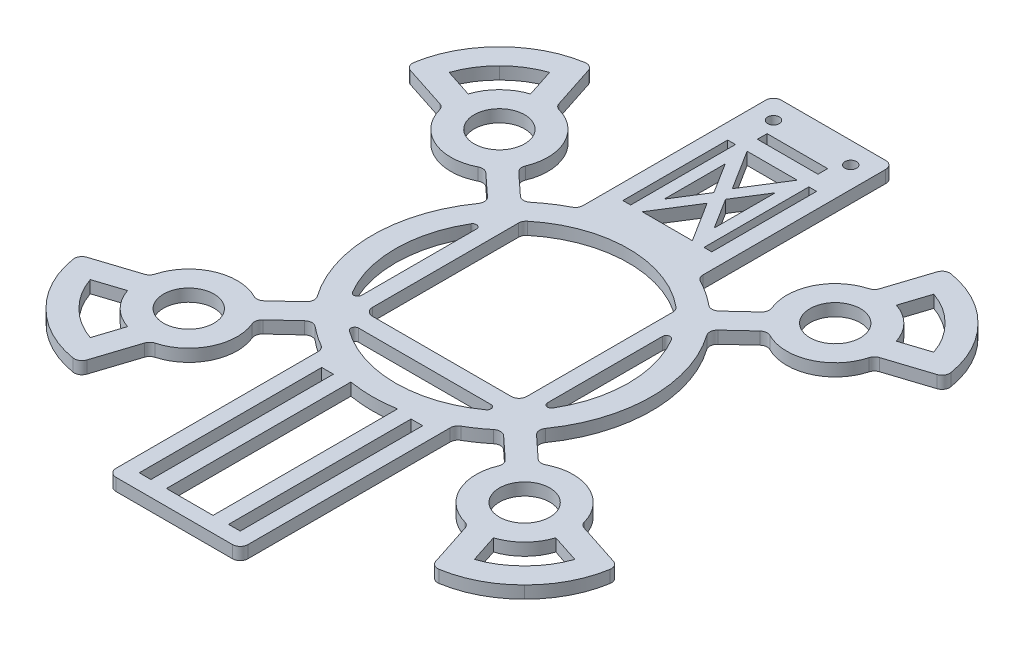
from build123d import *

# Parameters (mm, degrees)
SKETCH2_R           = 6.5
BASE_DEPTH          = 3.175
SKETCH3_R           = 1.5
SKETCH3_W           = 15.6
SKETCH3_H           = 2.5
SKETCH3_W_2         = 2
SKETCH3_H_2         = 27
FRONTPLATFORM_DEPTH = 3.175
SKETCH4_W           = 3
SKETCH4_H           = 47
BOSS_EXTRUDE4_DEPTH = 3.175
FILLET1_R           = 2
FILLET2_R           = 1


with BuildPart() as part:
    # Sketch2 → Base (new body)
    with BuildSketch(Plane(origin=(0, 0, 0), x_dir=(1, 0, 0), z_dir=(0, 1, 0))):
        with BuildLine():
            Line((6.871735206, 69.558292512), (14.875490896, 62.155975111))
            ThreePointArc((14.875490896, 62.155975111), (7.25, 40), (14.875490896, 17.844024889))
            Line((14.875490896, 17.844024889), (6.871735206, 10.441707488))
            ThreePointArc((6.871735206, 10.441707488), (-4.87874237, 11.508599953), (-12.282471793, 2.321828299))
            Line((-12.282471793, 2.321828299), (-26.132402851, -2.173145214))
            ThreePointArc((-26.132402851, -2.173145214), (-23.688748735, -10.96247499), (-18.385031899, -18.385031899))
            ThreePointArc((-18.385031899, -18.385031899), (-10.96247499, -23.688748735), (-2.173145214, -26.132402851))
            Line((-2.173145214, -26.132402851), (2.321828299, -12.282471793))
            ThreePointArc((2.321828299, -12.282471793), (11.3095237, -5.323971607), (10.945644046, 6.036793554))
            Line((10.945644046, 6.036793554), (18.949399736, 13.439110956))
            ThreePointArc((18.949399736, 13.439110956), (43.25, 4), (67.550600264, 13.439110956))
            Line((67.550600264, 13.439110956), (75.554355954, 6.036793554))
            ThreePointArc((75.554355954, 6.036793554), (75.1904763, -5.323971607), (84.178171701, -12.282471793))
            Line((84.178171701, -12.282471793), (88.673145214, -26.132402851))
            ThreePointArc((88.673145214, -26.132402851), (97.46247499, -23.688748735), (104.885031899, -18.385031899))
            ThreePointArc((104.885031899, -18.385031899), (110.188748735, -10.96247499), (112.632402851, -2.173145214))
            Line((112.632402851, -2.173145214), (98.782471793, 2.321828299))
            ThreePointArc((98.782471793, 2.321828299), (91.37874237, 11.508599953), (79.628264794, 10.441707488))
            Line((79.628264794, 10.441707488), (71.624509104, 17.844024889))
            ThreePointArc((71.624509104, 17.844024889), (79.25, 40), (71.624509104, 62.155975111))
            Line((71.624509104, 62.155975111), (79.628264794, 69.558292512))
            ThreePointArc((79.628264794, 69.558292512), (91.37874237, 68.491400047), (98.782471793, 77.678171701))
            Line((98.782471793, 77.678171701), (112.632402851, 82.173145214))
            ThreePointArc((112.632402851, 82.173145214), (110.188748735, 90.96247499), (104.885031899, 98.385031899))
            ThreePointArc((104.885031899, 98.385031899), (97.46247499, 103.688748735), (88.673145214, 106.132402851))
            Line((88.673145214, 106.132402851), (84.178171701, 92.282471793))
            ThreePointArc((84.178171701, 92.282471793), (75.1904763, 85.323971607), (75.554355954, 73.963206446))
            Line((75.554355954, 73.963206446), (67.550600264, 66.560889044))
            ThreePointArc((67.550600264, 66.560889044), (43.25, 76), (18.949399736, 66.560889044))
            Line((18.949399736, 66.560889044), (10.945644046, 73.963206446))
            ThreePointArc((10.945644046, 73.963206446), (11.3095237, 85.323971607), (2.321828299, 92.282471793))
            Line((2.321828299, 92.282471793), (-2.173145214, 106.132402851))
            ThreePointArc((-2.173145214, 106.132402851), (-10.96247499, 103.688748735), (-18.385031899, 98.385031899))
            ThreePointArc((-18.385031899, 98.385031899), (-23.688748735, 90.96247499), (-26.132402851, 82.173145214))
            Line((-26.132402851, 82.173145214), (-12.282471793, 77.678171701))
            ThreePointArc((-12.282471793, 77.678171701), (-4.87874237, 68.491400047), (6.871735206, 69.558292512))
        make_face()
        with BuildLine():
            ThreePointArc((-11.889503042, -3.858719659), (-8.838834765, -8.838834765), (-3.858719659, -11.889503042))
            Line((-3.858719659, -11.889503042), (-6.217580372, -19.157634468))
            ThreePointArc((-6.217580372, -19.157634468), (-10.474141293, -17.114856588), (-14.142135624, -14.142135624))
            ThreePointArc((-14.142135624, -14.142135624), (-17.114856588, -10.474141293), (-19.157634468, -6.217580372))
            Line((-19.157634468, -6.217580372), (-11.889503042, -3.858719659))
        make_face(mode=Mode.SUBTRACT)
        with Locations(Location((0, 0, 0), (0, 0, 270))):
            Circle(SKETCH2_R, mode=Mode.SUBTRACT)
        with BuildLine():
            ThreePointArc((90.358719659, -11.889503042), (95.338834765, -8.838834765), (98.389503042, -3.858719659))
            Line((98.389503042, -3.858719659), (105.657634468, -6.217580372))
            ThreePointArc((105.657634468, -6.217580372), (103.614856588, -10.474141293), (100.642135624, -14.142135624))
            ThreePointArc((100.642135624, -14.142135624), (96.974141293, -17.114856588), (92.717580372, -19.157634468))
            Line((92.717580372, -19.157634468), (90.358719659, -11.889503042))
        make_face(mode=Mode.SUBTRACT)
        with Locations(Location((86.5, 0, 0), (0, 0, 270))):
            Circle(SKETCH2_R, mode=Mode.SUBTRACT)
        with BuildLine():
            Line((23.372784293, 17.530102454), (63.127215707, 17.530102454))
            ThreePointArc((63.127215707, 17.530102454), (43.25, 10), (23.372784293, 17.530102454))
        make_face(mode=Mode.SUBTRACT)
        with BuildLine():
            Line((19.298875453, 58.064983613), (19.298875453, 21.935016387))
            ThreePointArc((19.298875453, 21.935016387), (13.25, 40), (19.298875453, 58.064983613))
        make_face(mode=Mode.SUBTRACT)
        with BuildLine():
            Line((63.127215707, 62.469897546), (63.127215707, 21.935016387))
            Line((63.127215707, 21.935016387), (23.372784293, 21.935016387))
            Line((23.372784293, 21.935016387), (23.372784293, 62.469897546))
            ThreePointArc((23.372784293, 62.469897546), (43.25, 70), (63.127215707, 62.469897546))
        make_face(mode=Mode.SUBTRACT)
        with Locations(Location((0, 80, 0), (0, 0, 270))):
            Circle(SKETCH2_R, mode=Mode.SUBTRACT)
        with BuildLine():
            ThreePointArc((-3.858719659, 91.889503042), (-8.838834765, 88.838834765), (-11.889503042, 83.858719659))
            Line((-11.889503042, 83.858719659), (-19.157634468, 86.217580372))
            ThreePointArc((-19.157634468, 86.217580372), (-17.114856588, 90.474141293), (-14.142135624, 94.142135624))
            ThreePointArc((-14.142135624, 94.142135624), (-10.474141293, 97.114856588), (-6.217580372, 99.157634468))
            Line((-6.217580372, 99.157634468), (-3.858719659, 91.889503042))
        make_face(mode=Mode.SUBTRACT)
        with BuildLine():
            ThreePointArc((67.201124547, 58.064983613), (73.25, 40), (67.201124547, 21.935016387))
            Line((67.201124547, 21.935016387), (67.201124547, 58.064983613))
        make_face(mode=Mode.SUBTRACT)
        with Locations(Location((86.5, 80, 0), (0, 0, 270))):
            Circle(SKETCH2_R, mode=Mode.SUBTRACT)
        with BuildLine():
            ThreePointArc((98.389503042, 83.858719659), (95.338834765, 88.838834765), (90.358719659, 91.889503042))
            Line((90.358719659, 91.889503042), (92.717580372, 99.157634468))
            ThreePointArc((92.717580372, 99.157634468), (96.974141293, 97.114856588), (100.642135624, 94.142135624))
            ThreePointArc((100.642135624, 94.142135624), (103.614856588, 90.474141293), (105.657634468, 86.217580372))
            Line((105.657634468, 86.217580372), (98.389503042, 83.858719659))
        make_face(mode=Mode.SUBTRACT)
    extrude(amount=BASE_DEPTH)

    # Sketch3 → FrontPlatform (add)
    with BuildSketch(Plane(origin=(0, 0, 0), x_dir=(1, 0, 0), z_dir=(0, 1, 0))):
        with BuildLine():
            Line((27.8, 122.8), (58.7, 122.8))
            Line((58.7, 122.8), (58.7, 72.516111391))
            ThreePointArc((58.7, 72.516111391), (43.25, 76), (27.8, 72.516111391))
            Line((27.8, 72.516111391), (27.8, 122.8))
        make_face()
        with Locations(Location((33.3, 117.3, 0), (0, 0, 270))):
            Circle(SKETCH3_R, mode=Mode.SUBTRACT)
        with Locations(Location((53.2, 117.3, 0), (0, 0, 90))):
            Circle(SKETCH3_R, mode=Mode.SUBTRACT)
        with Locations((43.25, 112.25)):
            Rectangle(SKETCH3_W, SKETCH3_H, mode=Mode.SUBTRACT)
        with Locations((32.8, 93.5)):
            Rectangle(SKETCH3_W_2, SKETCH3_H_2, mode=Mode.SUBTRACT)
        with Locations((53.7, 93.5)):
            Rectangle(SKETCH3_W_2, SKETCH3_H_2, mode=Mode.SUBTRACT)
        Polygon((36.8, 107), (43.25, 96.749211901), (49.7, 107), align=None, mode=Mode.SUBTRACT)
        Polygon((36.8, 101.36688389), (36.8, 85.63311611), (41.75, 93.5), align=None, mode=Mode.SUBTRACT)
        Polygon((36.8, 80), (49.7, 80), (43.25, 90.250788099), align=None, mode=Mode.SUBTRACT)
        Polygon((49.7, 85.63311611), (44.75, 93.5), (49.7, 101.36688389), align=None, mode=Mode.SUBTRACT)
    extrude(amount=FRONTPLATFORM_DEPTH)

    # Sketch4 → Boss-Extrude4 (add)
    with BuildSketch(Plane(origin=(0, 0, 0), x_dir=(1, 0, 0), z_dir=(0, 1, 0))):
        with BuildLine():
            Line((26.25, -47), (60.25, -47))
            Line((60.25, -47), (60.25, 8.266736695))
            ThreePointArc((60.25, 8.266736695), (54.902915838, 5.938151071), (49.25, 4.503521301))
            Line((49.25, 4.503521301), (49.25, -43))
            Line((49.25, -43), (37.25, -43))
            Line((37.25, -43), (37.25, 4.503521301))
            ThreePointArc((37.25, 4.503521301), (31.597084162, 5.938151071), (26.25, 8.266736695))
            Line((26.25, 8.266736695), (26.25, -47))
        make_face()
        with Locations((54.75, -19.5)):
            Rectangle(SKETCH4_W, SKETCH4_H, mode=Mode.SUBTRACT)
        with Locations((31.75, -19.5)):
            Rectangle(SKETCH4_W, SKETCH4_H, mode=Mode.SUBTRACT)
    extrude(amount=BOSS_EXTRUDE4_DEPTH)

    # Fillet1
    fillet1_edges = [part.edges().sort_by_distance(p)[0] for p in [
        (18.949399736, 1.5875, -13.439110956),
        (10.945644046, 1.5875, -6.036793554),
        (2.321828299, 1.5875, 12.282471793),
        (-2.173145214, 1.5875, 26.132402851),
        (-26.132402851, 1.5875, 2.173145214),
        (-12.282471793, 1.5875, -2.321828299),
        (6.871735206, 1.5875, -10.441707488),
        (14.875490896, 1.5875, -17.844024889),
        (14.875490896, 1.5875, -62.155975111),
        (6.871735206, 1.5875, -69.558292512),
        (-12.282471793, 1.5875, -77.678171701),
        (-26.132402851, 1.5875, -82.173145214),
        (-2.173145214, 1.5875, -106.132402851),
        (2.321828299, 1.5875, -92.282471793),
        (10.945644046, 1.5875, -73.963206446),
        (18.949399736, 1.5875, -66.560889044),
        (67.550600264, 1.5875, -66.560889044),
        (75.554355954, 1.5875, -73.963206446),
        (84.178171701, 1.5875, -92.282471793),
        (88.673145214, 1.5875, -106.132402851),
        (112.632402851, 1.5875, -82.173145214),
        (98.782471793, 1.5875, -77.678171701),
        (79.628264794, 1.5875, -69.558292512),
        (71.624509104, 1.5875, -62.155975111),
        (71.624509104, 1.5875, -17.844024889),
        (79.628264794, 1.5875, -10.441707488),
        (98.782471793, 1.5875, -2.321828299),
        (112.632402851, 1.5875, 2.173145214),
        (88.673145214, 1.5875, 26.132402851),
        (84.178171701, 1.5875, 12.282471793),
        (75.554355954, 1.5875, -6.036793554),
        (67.550600264, 1.5875, -13.439110956),
        (23.372784293, 1.5875, -62.469897546),
        (23.372784293, 1.5875, -21.935016387),
        (63.127215707, 1.5875, -21.935016387),
        (63.127215707, 1.5875, -62.469897546),
        (58.7, 1.5875, -122.8),
        (58.7, 1.5875, -72.516111391),
        (27.8, 1.5875, -72.516111391),
        (27.8, 1.5875, -122.8),
        (60.25, 1.5875, -8.266736695),
        (60.25, 1.5875, 47),
        (26.25, 1.5875, 47),
        (26.25, 1.5875, -8.266736695),
    ]]
    fillet(fillet1_edges, radius=FILLET1_R)

    # Fillet2
    fillet2_edges = [part.edges().sort_by_distance(p)[0] for p in [
        (23.372784293, 1.5875, -17.530102454),
        (63.127215707, 1.5875, -17.530102454),
        (67.201124547, 1.5875, -58.064983613),
        (67.201124547, 1.5875, -21.935016387),
        (19.298875453, 1.5875, -21.935016387),
        (19.298875453, 1.5875, -58.064983613),
    ]]
    fillet(fillet2_edges, radius=FILLET2_R)


solid = part.part
